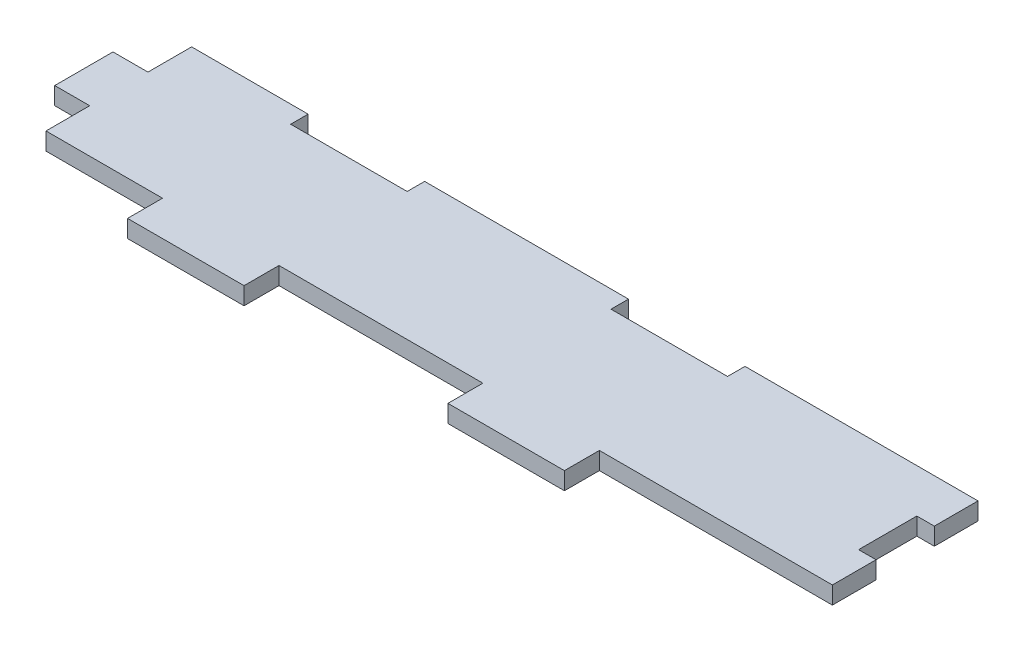
from build123d import *

# Parameters (mm, degrees)
EXTRUDE_1_DEPTH = 3


with BuildPart() as part:
    # Эскиз1 → Бобышка-Вытянуть1 (new body)
    with BuildSketch(Plane(origin=(0, 0, 0), x_dir=(1, 0, 0), z_dir=(0, 1, 0))):
        Polygon((135, 17.5), (135, 25), (95, 25), (95, 22), (75, 22), (75, 25), (40, 25), (40, 22), (20, 22), (20, 25), (0, 25), (0, 17.5), (-6, 17.5), (-6, 7.5), (0, 7.5), (0, 0), (20, 0), (20, -6), (40, -6), (40, 0), (75, 0), (75, -6), (95, -6), (95, 0), (135, 0), (135, 7.5), (132, 7.5), (132, 17.5), align=None)
    extrude(amount=EXTRUDE_1_DEPTH)


solid = part.part
